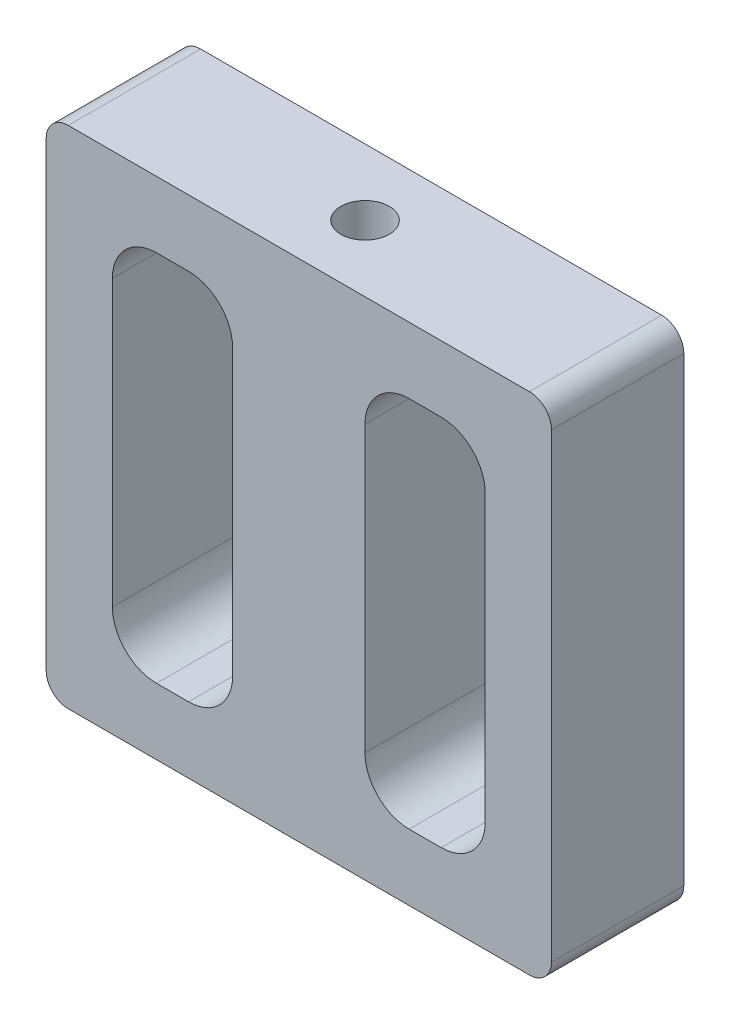
from build123d import *

# Parameters (mm, degrees)
SKETCH_1_W          = 22.9
SKETCH_1_H          = 22.9
EXTRUDE_1_DEPTH     = 6
SKETCH_2_R          = 1.1
CUT_EXTRUDE_1_DEPTH = 27.296625259
SKETCH_3_W          = 5.45
SKETCH_3_H          = 16.9
CUT_EXTRUDE_2_DEPTH = 6
FILLET_1_R          = 2
FILLET_2_R          = 1


with BuildPart() as part:
    # 草图1 → 凸台-拉伸1 (new body)
    with BuildSketch(Plane.XY):
        Rectangle(SKETCH_1_W, SKETCH_1_H)
    extrude(amount=EXTRUDE_1_DEPTH)

    # 草图2 → 切除-拉伸1 (cut, through all)
    with BuildSketch(Plane(origin=(0, 11.45, 0), x_dir=(1, 0, 0), z_dir=(0, 1, 0))):
        with Locations(Location((0, -3, 0), (0, 0, 180))):
            Circle(SKETCH_2_R)
    extrude(amount=-CUT_EXTRUDE_1_DEPTH, mode=Mode.SUBTRACT)

    # 草图3 → 切除-拉伸2 (cut)
    with BuildSketch(Plane(origin=(0, 0, 0), x_dir=(-1, 0, 0), z_dir=(0, 0, -1))):
        with Locations((5.725, 0)):
            Rectangle(SKETCH_3_W, SKETCH_3_H)
        with Locations((-5.725, 0)):
            Rectangle(SKETCH_3_W, SKETCH_3_H)
    extrude(amount=-CUT_EXTRUDE_2_DEPTH, mode=Mode.SUBTRACT)

    # 圆角1
    fillet_1_edges = [part.edges().sort_by_distance(p)[0] for p in [
        (-8.45, 8.45, 3),
        (-8.45, -8.45, 3),
        (-3, -8.45, 3),
        (-3, 8.45, 3),
        (3, 8.45, 3),
        (3, -8.45, 3),
        (8.45, -8.45, 3),
        (8.45, 8.45, 3),
    ]]
    fillet(fillet_1_edges, radius=FILLET_1_R)

    # 圆角2
    fillet_2_edges = [part.edges().sort_by_distance(p)[0] for p in [
        (-11.45, 11.45, 3),
        (11.45, 11.45, 3),
        (11.45, -11.45, 3),
        (-11.45, -11.45, 3),
    ]]
    fillet(fillet_2_edges, radius=FILLET_2_R)


solid = part.part
